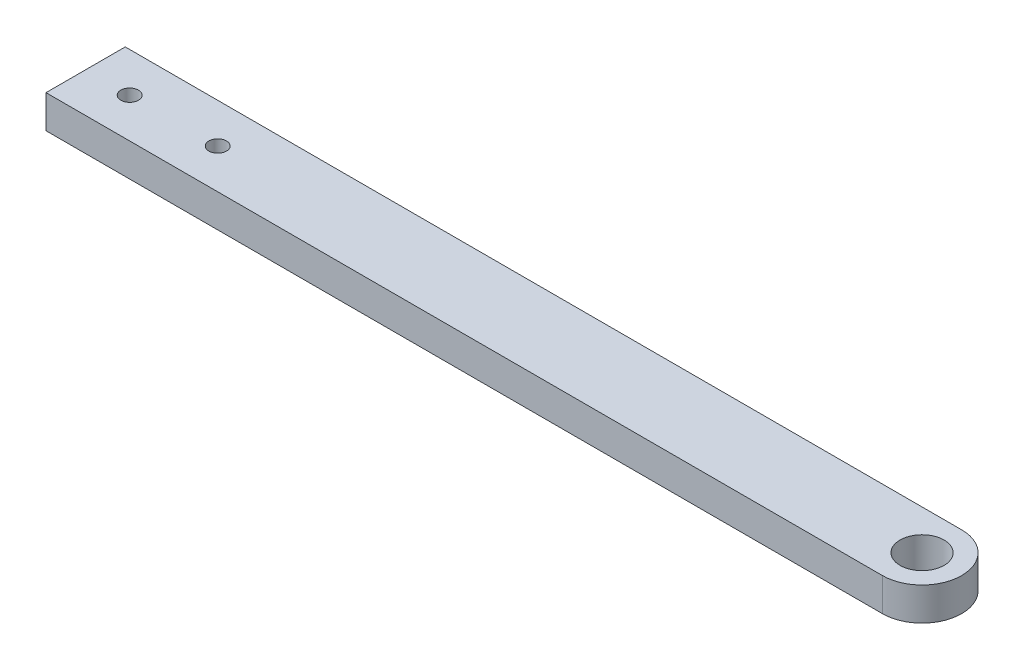
from build123d import *

# Parameters (mm, degrees)
BOSS_EXTRUDE1_DEPTH = 7.5
SKETCH2_R           = 2
CUT_EXTRUDE1_DEPTH  = 191.360841561
SKETCH3_R           = 5
CUT_EXTRUDE2_DEPTH  = 191.360841561


with BuildPart() as part:
    # Sketch1 → Boss-Extrude1 (new body)
    with BuildSketch(Plane(origin=(0, 0, 0), x_dir=(1, 0, 0), z_dir=(0, 1, 0))):
        with BuildLine():
            Line((0, 9), (-190, 9))
            Line((-190, 9), (-190, -9))
            Line((-190, -9), (0, -9))
            ThreePointArc((0, -9), (9, 0), (0, 9))
        make_face()
    extrude(amount=BOSS_EXTRUDE1_DEPTH)

    # Sketch2 → Cut-Extrude1 (cut, through all)
    with BuildSketch(Plane(origin=(0, 7.5, 0), x_dir=(1, 0, 0), z_dir=(0, 1, 0))):
        with Locations(Location((-180, 0, 0), (0, 0, 270))):
            Circle(SKETCH2_R)
        with Locations(Location((-160, 0, 0), (0, 0, 270))):
            Circle(SKETCH2_R)
    extrude(amount=-CUT_EXTRUDE1_DEPTH, mode=Mode.SUBTRACT)

    # Sketch3 → Cut-Extrude2 (cut, through all)
    with BuildSketch(Plane(origin=(0, 7.5, 0), x_dir=(1, 0, 0), z_dir=(0, 1, 0))):
        with Locations(Location((0, 0, 0), (0, 0, 270))):
            Circle(SKETCH3_R)
    extrude(amount=-CUT_EXTRUDE2_DEPTH, mode=Mode.SUBTRACT)


solid = part.part
